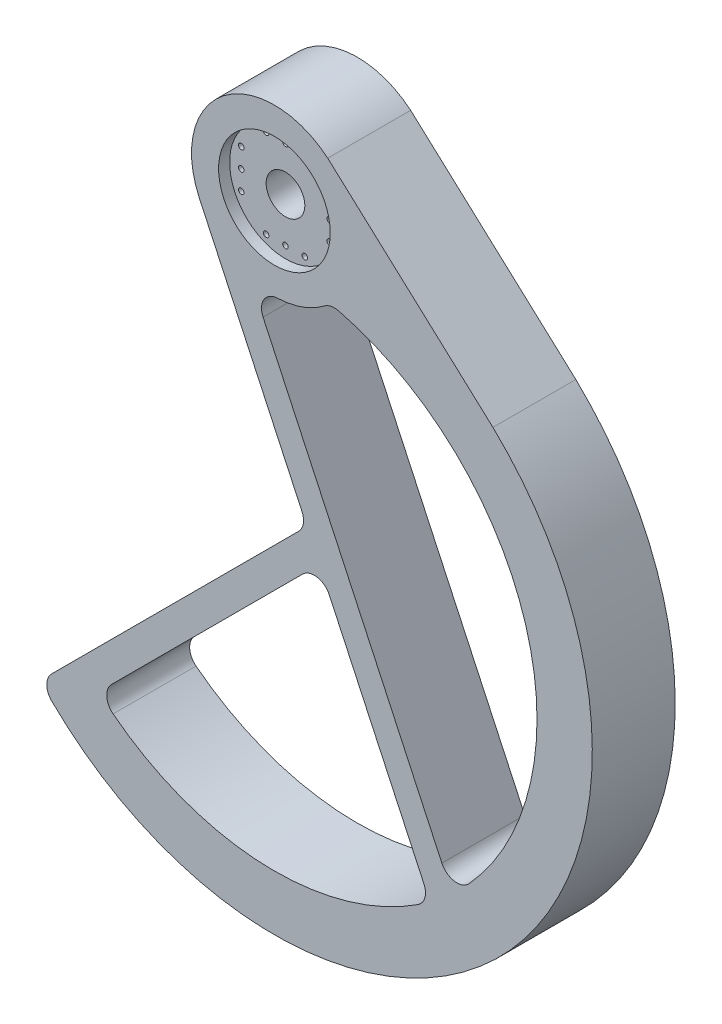
from build123d import *

# Parameters (mm, degrees)
EXTRUDE_1_DEPTH     = 15
SKETCH_6_R          = 3.5
CUT_EXTRUDE_2_DEPTH = 15
SKETCH_7_R          = 10.1
CUT_EXTRUDE_3_DEPTH = 2
SKETCH_8_R          = 0.5
CUT_EXTRUDE_4_DEPTH = 3


with BuildPart() as part:
    # ｽｹｯﾁ1 → ﾎﾞｽ - 押し出し1 (new body)
    with BuildSketch(Plane.XY):
        with BuildLine():
            Line((10.546944731, 68.165925034), (9.641814145, 68.990666647))
            ThreePointArc((9.641814145, 68.990666647), (-9.131421435, 69.400300104), (-13.594616806, 51.160726074))
            Line((-13.594616806, 51.160726074), (4.986432096, 11.313538113))
            ThreePointArc((4.986432096, 11.313538113), (5.221931994, 9.524738795), (4.388829079, 7.924362985))
            Line((4.388829079, 7.924362985), (-40.303464689, -36.767930783))
            ThreePointArc((-40.303464689, -36.767930783), (-41.182112782, -38.903012739), (-40.283913759, -41.029943849))
            ThreePointArc((-40.283913759, -41.029943849), (41.397896806, -39.905690573), (39.524106652, 41.762363359))
            Line((39.524106652, 41.762363359), (37.916838192, 43.226882625))
            Line((37.916838192, 43.226882625), (10.546944731, 68.165925034))
        make_face()
        with BuildLine():
            ThreePointArc((5.093338956, 1.55780505), (7.735603832, 2.390907965), (9.933582661, 0.704339492))
            Line((9.933582661, 0.704339492), (27.046217634, -35.993824637))
            ThreePointArc((27.046217634, -35.993824637), (27.212084573, -38.085077821), (25.967336583, -39.773702754))
            ThreePointArc((25.967336583, -39.773702754), (-1.972837213, -47.459012983), (-29.17877254, -37.481318454))
            ThreePointArc((-29.17877254, -37.481318454), (-30.330146685, -35.299826939), (-29.457223039, -32.992756945))
            Line((-29.457223039, -32.992756945), (5.093338956, 1.55780505))
        make_face(mode=Mode.SUBTRACT)
        with BuildLine():
            ThreePointArc((35.231836325, -31.858557864), (32.560090836, -32.813013733), (30.287744354, -31.114293205))
            Line((30.287744354, -31.114293205), (-2.054746852, 38.244403012))
            ThreePointArc((-2.054746852, 38.244403012), (-1.895310582, 41.077194163), (0.553480425, 42.510214831))
            ThreePointArc((0.553480425, 42.510214831), (5.039223996, 43.371793408), (9.057681155, 45.543478261))
            ThreePointArc((9.057681155, 45.543478261), (10.270904088, 46.091905397), (11.601973614, 46.061309233))
            ThreePointArc((11.601973614, 46.061309233), (45.455779175, 13.784851815), (35.231836325, -31.858557864))
        make_face(mode=Mode.SUBTRACT)
    extrude(amount=EXTRUDE_1_DEPTH)

    # ｽｹｯﾁ6 → ｶｯﾄ - 押し出し2 (cut)
    with BuildSketch(Plane.XY.offset(15)):
        with Locations((0, 57.5)):
            Circle(SKETCH_6_R)
    extrude(amount=-CUT_EXTRUDE_2_DEPTH, mode=Mode.SUBTRACT)

    # ｽｹｯﾁ7 → ｶｯﾄ - 押し出し3 (cut)
    with BuildSketch(Plane.XY.offset(15)):
        with Locations((0, 57.5)):
            Circle(SKETCH_7_R)
    extrude(amount=-CUT_EXTRUDE_3_DEPTH, mode=Mode.SUBTRACT)

    # ｽｹｯﾁ8 → ｶｯﾄ - 押し出し4 (cut)
    with BuildSketch(Plane.XY.offset(13)):
        with Locations((-3.5, 65.5)):
            Circle(SKETCH_8_R)
        with Locations((0, 65.5)):
            Circle(SKETCH_8_R)
        with Locations((3.5, 65.5)):
            Circle(SKETCH_8_R)
        with Locations((8, 57.5)):
            Circle(SKETCH_8_R)
        with Locations((8, 61)):
            Circle(SKETCH_8_R)
        with Locations((8, 54)):
            Circle(SKETCH_8_R)
        with Locations((0, 49.5)):
            Circle(SKETCH_8_R)
        with Locations((3.5, 49.5)):
            Circle(SKETCH_8_R)
        with Locations((-3.5, 49.5)):
            Circle(SKETCH_8_R)
        with Locations((-8, 57.5)):
            Circle(SKETCH_8_R)
        with Locations((-8, 54)):
            Circle(SKETCH_8_R)
        with Locations((-8, 61)):
            Circle(SKETCH_8_R)
    extrude(amount=-CUT_EXTRUDE_4_DEPTH, mode=Mode.SUBTRACT)


solid = part.part
